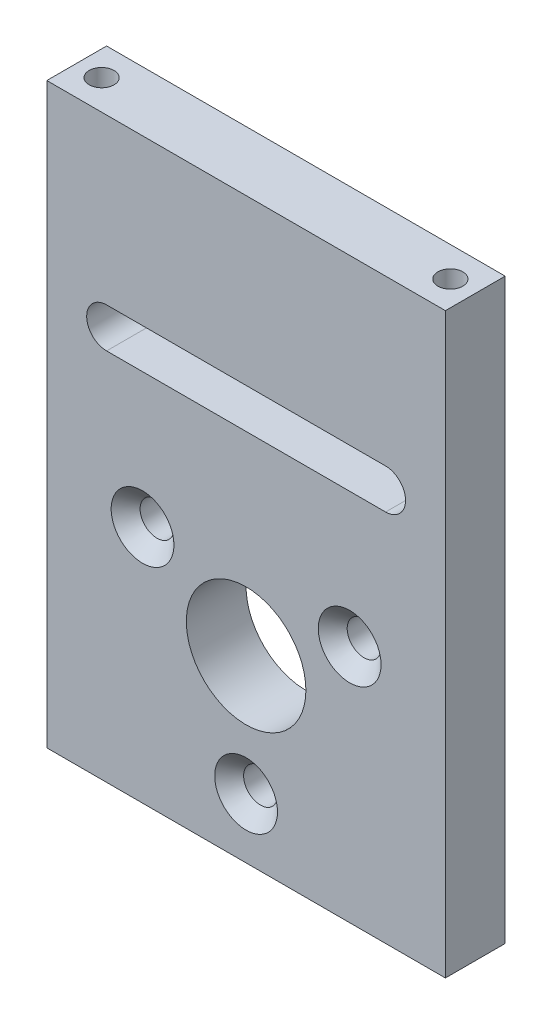
from build123d import *

# Parameters (mm, degrees)
SKETCH1_W                                           = 40
SKETCH1_H                                           = 58
BOSS_EXTRUDE1_DEPTH                                 = 3
SKETCH2_R                                           = 6
CUT_EXTRUDE1_DEPTH                                  = 36.73513677
CSK_FOR_M3_COUNTERSUNK_FLAT_HEAD_SCREW1_D           = 3.4
CSK_FOR_M3_COUNTERSUNK_FLAT_HEAD_SCREW1_CSINK_D     = 6.3
CSK_FOR_M3_COUNTERSUNK_FLAT_HEAD_SCREW1_CSINK_ANGLE = 90
TAP_DRILL_FOR_M3_TAP1_D                             = 2.5
TAP_DRILL_FOR_M3_TAP1_DEPTH                         = 9
TAP_DRILL_FOR_M3_TAP1_TIP                           = 0.751075774
TAP_DRILL_FOR_M3_TAP2_D                             = 2.5
TAP_DRILL_FOR_M3_TAP2_DEPTH                         = 9
TAP_DRILL_FOR_M3_TAP2_TIP                           = 0.751075774
CUT_EXTRUDE3_DEPTH                                  = 36.73513677


with BuildPart() as part:
    # Sketch1 → Boss-Extrude1 (new, symmetric)
    with BuildSketch(Plane.XY):
        Rectangle(SKETCH1_W, SKETCH1_H)
    extrude(amount=BOSS_EXTRUDE1_DEPTH, both=True)

    # Sketch2 → Cut-Extrude1 (cut, through all)
    with BuildSketch(Plane.XY.offset(3)):
        with Locations((0, -11)):
            Circle(SKETCH2_R)
    extrude(amount=-CUT_EXTRUDE1_DEPTH, mode=Mode.SUBTRACT)

    # CSK for M3 Countersunk Flat Head Screw1 (through all)
    with Locations(Plane.XY.offset(3)):
        with Locations((0, -23), (-10.392304845, -5), (10.392304845, -5)):
            CounterSinkHole(CSK_FOR_M3_COUNTERSUNK_FLAT_HEAD_SCREW1_D / 2, CSK_FOR_M3_COUNTERSUNK_FLAT_HEAD_SCREW1_CSINK_D / 2, counter_sink_angle=CSK_FOR_M3_COUNTERSUNK_FLAT_HEAD_SCREW1_CSINK_ANGLE)

    # Tap Drill for M3 Tap1
    with Locations(Plane(origin=(0, -29, 0), x_dir=(-1, 0, 0), z_dir=(0, -1, 0))):
        with Locations((10.75, 0), (-10.75, 0)):
            Hole(TAP_DRILL_FOR_M3_TAP1_D / 2, depth=TAP_DRILL_FOR_M3_TAP1_DEPTH)
            with Locations((0, 0, -(TAP_DRILL_FOR_M3_TAP1_DEPTH + TAP_DRILL_FOR_M3_TAP1_TIP / 2))):  # 118° drill point
                Cone(0, TAP_DRILL_FOR_M3_TAP1_D / 2, TAP_DRILL_FOR_M3_TAP1_TIP, mode=Mode.SUBTRACT)

    # Tap Drill for M3 Tap2
    with Locations(Plane(origin=(0, 29, 0), x_dir=(1, 0, 0), z_dir=(0, 1, 0))):
        with Locations((17.5, 0), (-17.5, 0)):
            Hole(TAP_DRILL_FOR_M3_TAP2_D / 2, depth=TAP_DRILL_FOR_M3_TAP2_DEPTH)
            with Locations((0, 0, -(TAP_DRILL_FOR_M3_TAP2_DEPTH + TAP_DRILL_FOR_M3_TAP2_TIP / 2))):  # 118° drill point
                Cone(0, TAP_DRILL_FOR_M3_TAP2_D / 2, TAP_DRILL_FOR_M3_TAP2_TIP, mode=Mode.SUBTRACT)

    # Sketch10 → Cut-Extrude3 (cut, through all)
    with BuildSketch(Plane.XY.offset(3)):
        with BuildLine():
            Line((-14, 12.5), (14, 12.5))
            ThreePointArc((14, 12.5), (16, 10.5), (14, 8.5))
            Line((14, 8.5), (-14, 8.5))
            ThreePointArc((-14, 8.5), (-16, 10.5), (-14, 12.5))
        make_face()
    extrude(amount=-CUT_EXTRUDE3_DEPTH, mode=Mode.SUBTRACT)


solid = part.part
